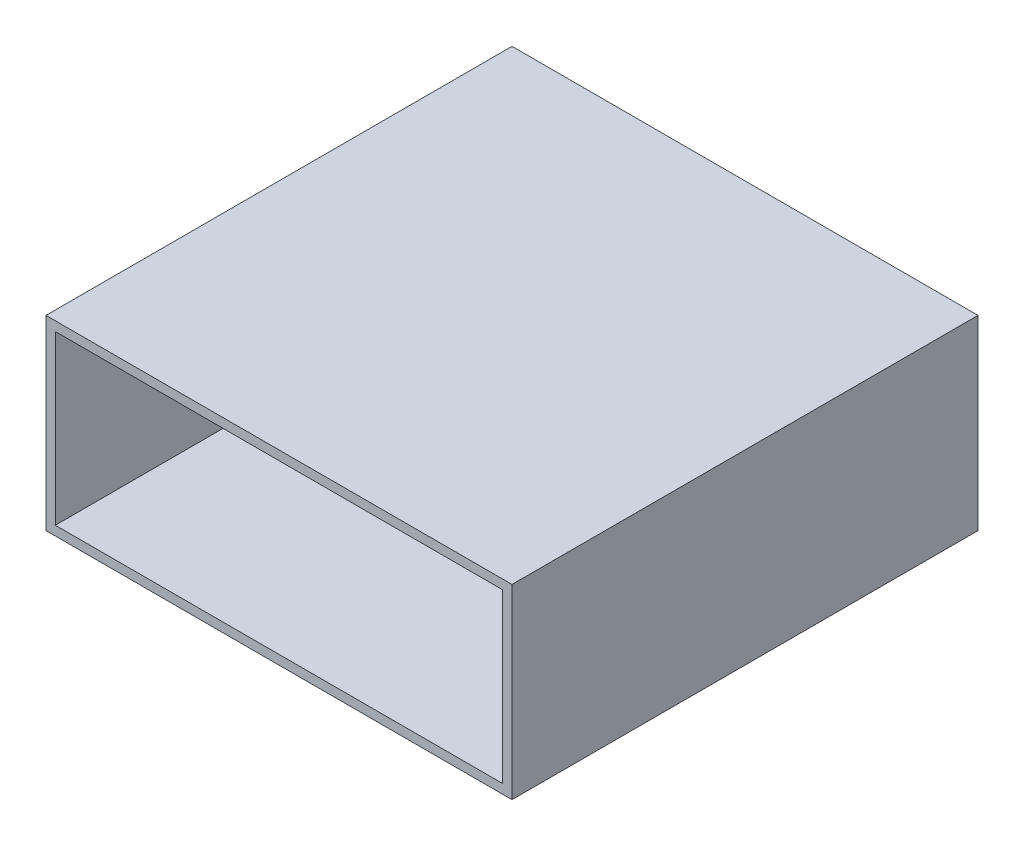
from build123d import *

# Parameters (mm, degrees)
SKETCH_1_W      = 50
SKETCH_1_H      = 20
SKETCH_1_W_2    = 48
SKETCH_1_H_2    = 18
EXTRUDE_1_DEPTH = 50


with BuildPart() as part:
    # 草图1 → 凸台-拉伸1 (new body)
    with BuildSketch(Plane.XY):
        with Locations((25, 10)):
            Rectangle(SKETCH_1_W, SKETCH_1_H)
        with Locations((25, 10)):
            Rectangle(SKETCH_1_W_2, SKETCH_1_H_2, mode=Mode.SUBTRACT)
    extrude(amount=EXTRUDE_1_DEPTH)


solid = part.part
